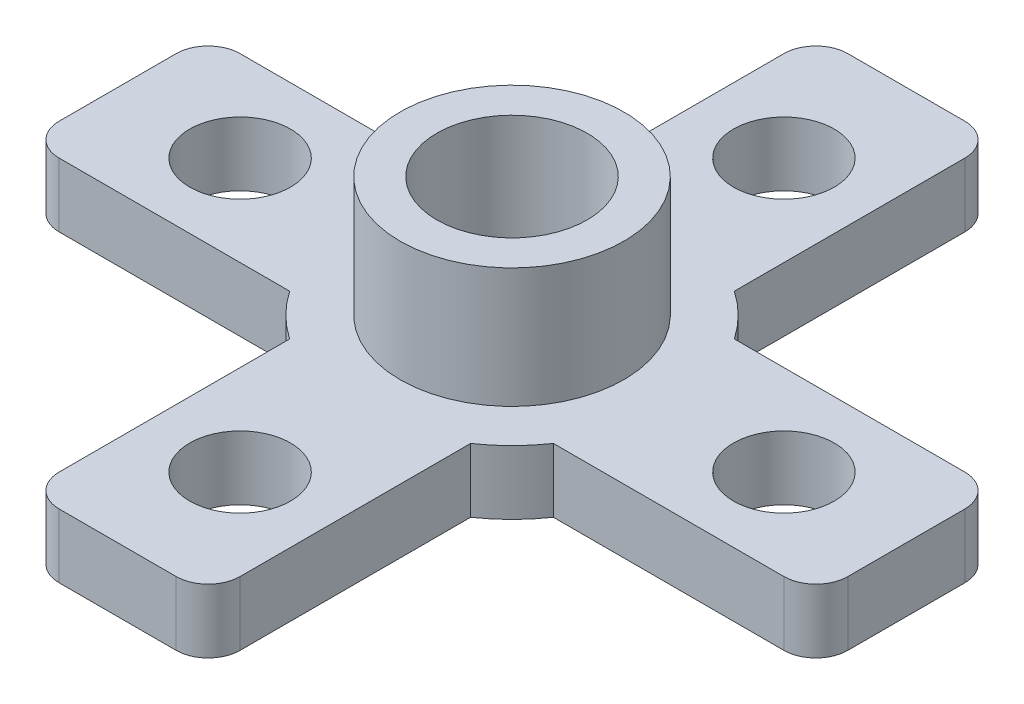
from build123d import *

# Parameters (mm, degrees)
SKETCH1_R             = 1.575
SKETCH1_R_2           = 3.5
BOSS_EXTRUDE1_DEPTH   = 2
SKETCH1_R_3           = 3
SKETCH1_R_4           = 1.125
BOSS_EXTRUDE1_2_DEPTH = 2
SKETCH1_3_R           = 3.5
SKETCH1_3_R_2         = 2.35
BOSS_EXTRUDE2_DEPTH   = 5.75
FILLET1_R             = 1
CUT_EXTRUDE1_DEPTH    = 1


with BuildPart() as part:
    # Sketch1 → Boss-Extrude1 (new body)
    with BuildSketch(Plane(origin=(0, 0, 0), x_dir=(1, 0, 0), z_dir=(0, 1, 0))):
        with BuildLine():
            ThreePointArc((-2.828427125, 4.123105626), (-3.535533906, 3.535533906), (-4.123105626, 2.828427125))
            Line((-4.123105626, 2.828427125), (-12.328427125, 2.828427125))
            Line((-12.328427125, 2.828427125), (-12.328427125, -2.828427125))
            Line((-12.328427125, -2.828427125), (-4.123105626, -2.828427125))
            ThreePointArc((-4.123105626, -2.828427125), (-3.535533906, -3.535533906), (-2.828427125, -4.123105626))
            Line((-2.828427125, -4.123105626), (-2.828427125, -12.328427125))
            Line((-2.828427125, -12.328427125), (2.828427125, -12.328427125))
            Line((2.828427125, -12.328427125), (2.828427125, -4.123105626))
            ThreePointArc((2.828427125, -4.123105626), (3.535533906, -3.535533906), (4.123105626, -2.828427125))
            Line((4.123105626, -2.828427125), (12.328427125, -2.828427125))
            Line((12.328427125, -2.828427125), (12.328427125, 2.828427125))
            Line((12.328427125, 2.828427125), (4.123105626, 2.828427125))
            ThreePointArc((4.123105626, 2.828427125), (3.535533906, 3.535533906), (2.828427125, 4.123105626))
            Line((2.828427125, 4.123105626), (2.828427125, 12.328427125))
            Line((2.828427125, 12.328427125), (-2.828427125, 12.328427125))
            Line((-2.828427125, 12.328427125), (-2.828427125, 4.123105626))
        make_face()
        with Locations(Location((0, -8.5, 0), (0, 0, 270))):
            Circle(SKETCH1_R, mode=Mode.SUBTRACT)
        with Locations(Location((0, 0, 0), (0, 0, 270))):
            Circle(SKETCH1_R_2, mode=Mode.SUBTRACT)
        with Locations(Location((0, 8.5, 0), (0, 0, 270))):
            Circle(SKETCH1_R, mode=Mode.SUBTRACT)
        with Locations(Location((8.5, 0, 0), (0, 0, 270))):
            Circle(SKETCH1_R, mode=Mode.SUBTRACT)
        with Locations(Location((-8.5, 0, 0), (0, 0, 270))):
            Circle(SKETCH1_R, mode=Mode.SUBTRACT)
    extrude(amount=BOSS_EXTRUDE1_DEPTH)

    # Sketch1<3> → Boss-Extrude2 (add)
    with BuildSketch(Plane(origin=(0, 0, 0), x_dir=(1, 0, 0), z_dir=(0, 1, 0))):
        with Locations(Location((0, 0, 0), (0, 0, 270))):
            Circle(SKETCH1_3_R)
        with Locations(Location((0, 0, 0), (0, 0, 270))):
            Circle(SKETCH1_3_R_2, mode=Mode.SUBTRACT)
    extrude(amount=BOSS_EXTRUDE2_DEPTH)

    # Fillet1
    fillet1_edges = [part.edges().sort_by_distance(p)[0] for p in [
        (-2.828427125, 1, -12.328427125),
        (2.828427125, 1, -12.328427125),
        (12.328427125, 1, -2.828427125),
        (12.328427125, 1, 2.828427125),
        (2.828427125, 1, 12.328427125),
        (-2.828427125, 1, 12.328427125),
        (-12.328427125, 1, 2.828427125),
        (-12.328427125, 1, -2.828427125),
    ]]
    fillet(fillet1_edges, radius=FILLET1_R)


with BuildPart() as body_2:
    # Sketch1 → Boss-Extrude1 2 (new body)
    with BuildSketch(Plane(origin=(0, 0, 0), x_dir=(1, 0, 0), z_dir=(0, 1, 0))):
        with Locations(Location((0, 0, 0), (0, 0, 270))):
            Circle(SKETCH1_R_3)
        with Locations(Location((0, 0, 0), (0, 0, 270))):
            Circle(SKETCH1_R_4, mode=Mode.SUBTRACT)
    extrude(amount=BOSS_EXTRUDE1_2_DEPTH)


with BuildPart() as cut_extrude1_tool:
    # Sketch1<4> → Cut-Extrude1 (new body)
    with BuildSketch(Plane(origin=(0, 0, 0), x_dir=(1, 0, 0), z_dir=(0, 1, 0))):
        with BuildLine():
            Line((1.661700936, 1.661700936), (2.121320344, 2.121320344))
            ThreePointArc((2.121320344, 2.121320344), (1.148050297, 2.771638598), (0, 3))
            Line((0, 3), (0, 2.35))
            ThreePointArc((0, 2.35), (0.899306066, 2.171116901), (1.661700936, 1.661700936))
        make_face()
        with BuildLine():
            ThreePointArc((3, 0), (2.771638598, 1.148050297), (2.121320344, 2.121320344))
            Line((2.121320344, 2.121320344), (1.661700936, 1.661700936))
            ThreePointArc((1.661700936, 1.661700936), (2.171116901, 0.899306066), (2.35, 0))
            ThreePointArc((2.35, 0), (2.171116901, -0.899306066), (1.661700936, -1.661700936))
            Line((1.661700936, -1.661700936), (2.121320344, -2.121320344))
            ThreePointArc((2.121320344, -2.121320344), (2.771638598, -1.148050297), (3, 0))
        make_face()
        with BuildLine():
            ThreePointArc((-2.121320344, -2.121320344), (0, -3), (2.121320344, -2.121320344))
            Line((2.121320344, -2.121320344), (1.661700936, -1.661700936))
            ThreePointArc((1.661700936, -1.661700936), (0, -2.35), (-1.661700936, -1.661700936))
            Line((-1.661700936, -1.661700936), (-2.121320344, -2.121320344))
        make_face()
        with BuildLine():
            Line((-1.661700936, 1.661700936), (-2.121320344, 2.121320344))
            ThreePointArc((-2.121320344, 2.121320344), (-3, 0), (-2.121320344, -2.121320344))
            Line((-2.121320344, -2.121320344), (-1.661700936, -1.661700936))
            ThreePointArc((-1.661700936, -1.661700936), (-2.35, 0), (-1.661700936, 1.661700936))
        make_face()
        with BuildLine():
            ThreePointArc((2.35, 0), (2.171116901, 0.899306066), (1.661700936, 1.661700936))
            Line((1.661700936, 1.661700936), (0.795495129, 0.795495129))
            ThreePointArc((0.795495129, 0.795495129), (1.039364474, 0.430518861), (1.125, 0))
            ThreePointArc((1.125, 0), (1.039364474, -0.430518861), (0.795495129, -0.795495129))
            Line((0.795495129, -0.795495129), (1.661700936, -1.661700936))
            ThreePointArc((1.661700936, -1.661700936), (2.171116901, -0.899306066), (2.35, 0))
        make_face()
        with BuildLine():
            ThreePointArc((-1.661700936, -1.661700936), (0, -2.35), (1.661700936, -1.661700936))
            Line((1.661700936, -1.661700936), (0.795495129, -0.795495129))
            ThreePointArc((0.795495129, -0.795495129), (0, -1.125), (-0.795495129, -0.795495129))
            Line((-0.795495129, -0.795495129), (-1.661700936, -1.661700936))
        make_face()
        with BuildLine():
            Line((-0.795495129, 0.795495129), (-1.661700936, 1.661700936))
            ThreePointArc((-1.661700936, 1.661700936), (-2.35, 0), (-1.661700936, -1.661700936))
            Line((-1.661700936, -1.661700936), (-0.795495129, -0.795495129))
            ThreePointArc((-0.795495129, -0.795495129), (-1.125, 0), (-0.795495129, 0.795495129))
        make_face()
        with BuildLine():
            Line((0.795495129, 0.795495129), (1.661700936, 1.661700936))
            ThreePointArc((1.661700936, 1.661700936), (0.899306066, 2.171116901), (0, 2.35))
            Line((0, 2.35), (0, 1.125))
            ThreePointArc((0, 1.125), (0.430518861, 1.039364474), (0.795495129, 0.795495129))
        make_face()
        with BuildLine():
            Line((0, 1.125), (0, 2.35))
            ThreePointArc((0, 2.35), (-0.899306066, 2.171116901), (-1.661700936, 1.661700936))
            Line((-1.661700936, 1.661700936), (-0.795495129, 0.795495129))
            ThreePointArc((-0.795495129, 0.795495129), (-0.430518861, 1.039364474), (0, 1.125))
        make_face()
        with BuildLine():
            Line((0, 2.35), (0, 3))
            ThreePointArc((0, 3), (-1.148050297, 2.771638598), (-2.121320344, 2.121320344))
            Line((-2.121320344, 2.121320344), (-1.661700936, 1.661700936))
            ThreePointArc((-1.661700936, 1.661700936), (-0.899306066, 2.171116901), (0, 2.35))
        make_face()
    extrude(amount=CUT_EXTRUDE1_DEPTH)


with BuildPart() as part_1:
    add(part.part)

    # Cut-Extrude1: cut by cut_extrude1_tool
    add(cut_extrude1_tool.part, mode=Mode.SUBTRACT)


with BuildPart() as body_2_1:
    add(body_2.part)

    # Cut-Extrude1: cut by cut_extrude1_tool
    add(cut_extrude1_tool.part, mode=Mode.SUBTRACT)


solid = Compound([part_1.part, body_2_1.part])
